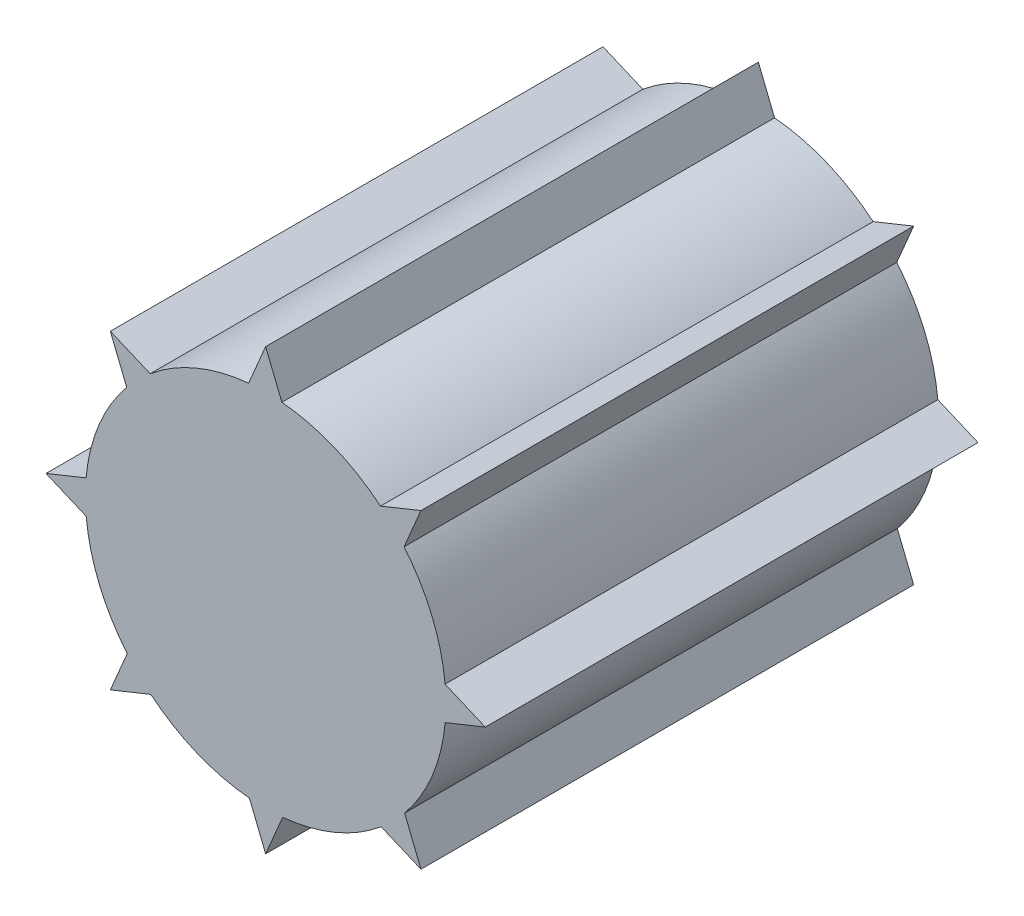
from build123d import *

# Parameters (mm, degrees)
SALIENTE_EXTRUIR1_DEPTH = 85


with BuildPart() as part:
    # Croquis1 → Saliente-Extruir1 (new body)
    with BuildSketch(Plane.XY):
        with BuildLine():
            Line((-2.940383589, 30.958198867), (0, 37.891714368))
            Line((0, 37.891714368), (2.798692732, 30.971329512))
            ThreePointArc((2.798692732, 30.971329512), (11.834742576, 28.757517294), (19.811587178, 23.969917527))
            Line((19.811587178, 23.969917527), (26.79348818, 26.79348818))
            Line((26.79348818, 26.79348818), (23.879011729, 19.921062511))
            ThreePointArc((23.879011729, 19.921062511), (28.703062218, 11.96620876), (30.958198867, 2.940383589))
            Line((30.958198867, 2.940383589), (37.891714368, 0))
            Line((37.891714368, 0), (30.971329512, -2.798692732))
            ThreePointArc((30.971329512, -2.798692732), (28.757517294, -11.834742576), (23.969917527, -19.811587178))
            Line((23.969917527, -19.811587178), (26.79348818, -26.79348818))
            Line((26.79348818, -26.79348818), (19.921062511, -23.879011729))
            ThreePointArc((19.921062511, -23.879011729), (11.96620876, -28.703062218), (2.940383589, -30.958198867))
            Line((2.940383589, -30.958198867), (0, -37.891714368))
            Line((0, -37.891714368), (-2.798692732, -30.971329512))
            ThreePointArc((-2.798692732, -30.971329512), (-11.834742576, -28.757517294), (-19.811587178, -23.969917527))
            Line((-19.811587178, -23.969917527), (-26.79348818, -26.79348818))
            Line((-26.79348818, -26.79348818), (-23.879011729, -19.921062511))
            ThreePointArc((-23.879011729, -19.921062511), (-28.703062218, -11.96620876), (-30.958198867, -2.940383589))
            Line((-30.958198867, -2.940383589), (-37.891714368, 0))
            Line((-37.891714368, 0), (-30.971329512, 2.798692732))
            ThreePointArc((-30.971329512, 2.798692732), (-28.757517294, 11.834742576), (-23.969917527, 19.811587178))
            Line((-23.969917527, 19.811587178), (-26.79348818, 26.79348818))
            Line((-26.79348818, 26.79348818), (-19.921062511, 23.879011729))
            ThreePointArc((-19.921062511, 23.879011729), (-11.96620876, 28.703062218), (-2.940383589, 30.958198867))
        make_face()
    extrude(amount=SALIENTE_EXTRUIR1_DEPTH)


solid = part.part
